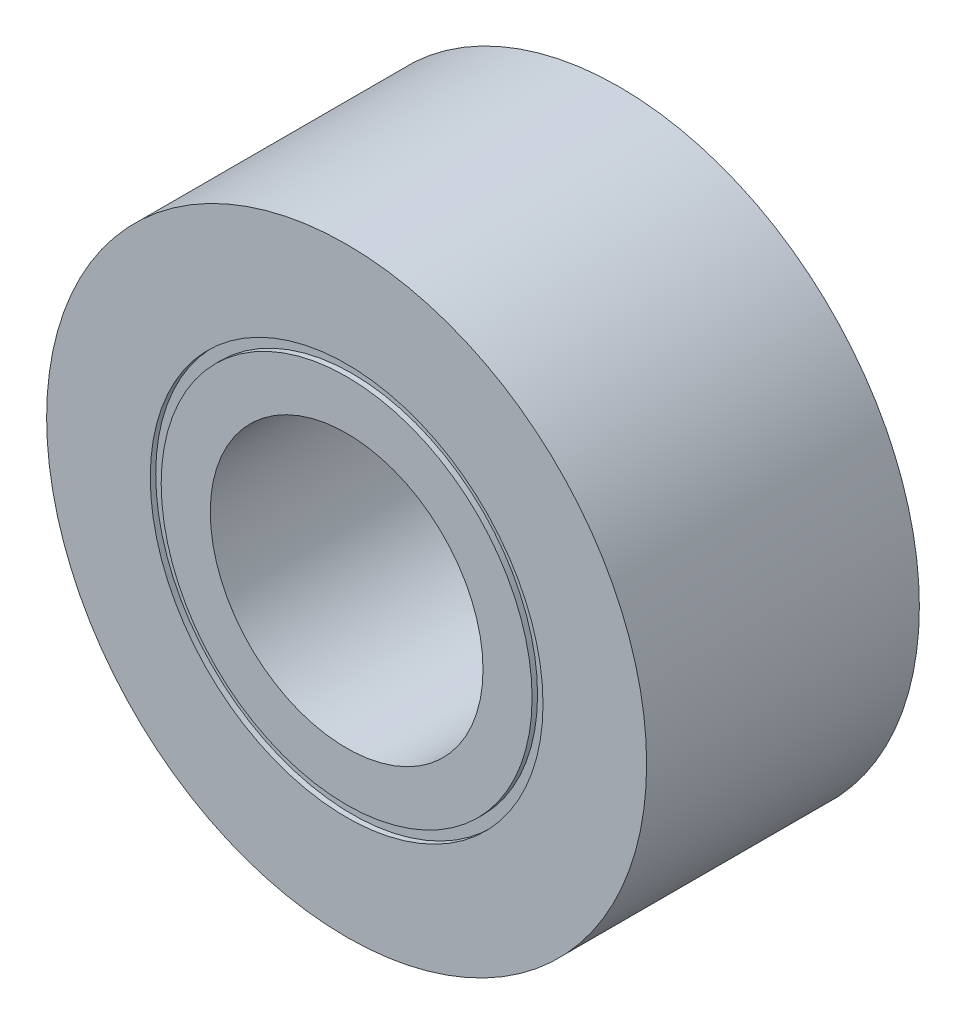
from build123d import *

# Parameters (mm, degrees)
SKETCH1_R           = 5.5
SKETCH1_R_2         = 2.5
BOSS_EXTRUDE1_DEPTH = 5
SKETCH2_R           = 3.6
SKETCH2_R_2         = 3.4
CUT_EXTRUDE1_DEPTH  = 0.1
CUT_EXTRUDE2_START  = -0.1
SKETCH3_R           = 3.8
SKETCH3_R_2         = 3.4
CUT_EXTRUDE2_DEPTH  = 0.1


with BuildPart() as part:
    # Sketch1 → Boss-Extrude1 (new body)
    with BuildSketch(Plane.XY):
        Circle(SKETCH1_R)
        Circle(SKETCH1_R_2, mode=Mode.SUBTRACT)
    extrude(amount=BOSS_EXTRUDE1_DEPTH)

    # Sketch2 → Cut-Extrude1 (cut)
    with BuildSketch(Plane.XY.offset(5)):
        Circle(SKETCH2_R)
        Circle(SKETCH2_R_2, mode=Mode.SUBTRACT)
    extrude(amount=-CUT_EXTRUDE1_DEPTH, mode=Mode.SUBTRACT)

    # Sketch3 → Cut-Extrude2 (cut)
    with BuildSketch(Plane(origin=(0, 0, 0), x_dir=(-1, 0, 0), z_dir=(0, 0, -1)).offset(CUT_EXTRUDE2_START)):
        Circle(SKETCH3_R)
        with Locations(Location((0, 0, 0), (0, 0, 180))):
            Circle(SKETCH3_R_2, mode=Mode.SUBTRACT)
    extrude(amount=CUT_EXTRUDE2_DEPTH, mode=Mode.SUBTRACT)


solid = part.part
